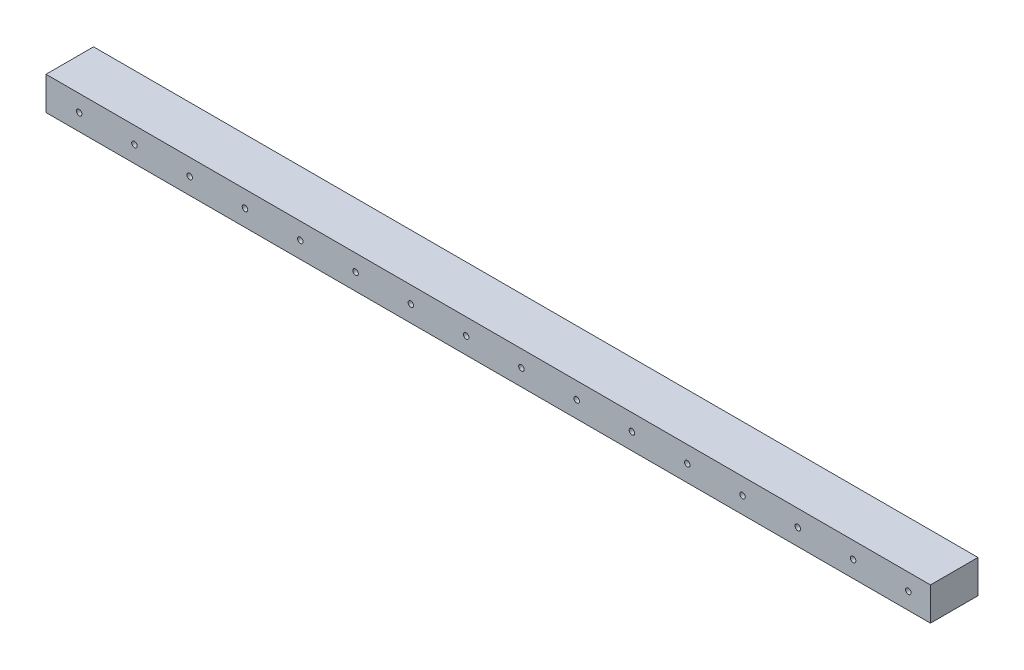
from build123d import *

# Parameters (mm, degrees)
SKETCH_1_W                  = 400
SKETCH_1_H                  = 21.5
EXTRUDE_1_DEPTH             = 15
HOLE_WIZARD_2_5_2_5_1_D     = 2.5
HOLE_WIZARD_2_5_2_5_1_DEPTH = 8.5
HOLE_WIZARD_2_5_2_5_1_TIP   = 0.751075774


with BuildPart() as part:
    # 草图1 → 凸台-拉伸1 (new body)
    with BuildSketch(Plane(origin=(0, 7.5, 0), x_dir=(1, 0, 0), z_dir=(0, 1, 0))):
        with Locations((0, -10.75)):
            Rectangle(SKETCH_1_W, SKETCH_1_H)
    extrude(amount=-EXTRUDE_1_DEPTH)

    # Ø2.5 (2.5) 直径孔1
    with Locations(Plane.XY.offset(21.5)):
        with Locations((-185, 0), (-160, 0), (-135, 0), (-110, 0), (-85, 0), (-60, 0), (-35, 0), (-10, 0), (15, 0), (40, 0), (65, 0), (90, 0), (115, 0), (140, 0), (190, 0), (165, 0)):
            Hole(HOLE_WIZARD_2_5_2_5_1_D / 2, depth=HOLE_WIZARD_2_5_2_5_1_DEPTH)
            with Locations((0, 0, -(HOLE_WIZARD_2_5_2_5_1_DEPTH + HOLE_WIZARD_2_5_2_5_1_TIP / 2))):  # 118° drill point
                Cone(0, HOLE_WIZARD_2_5_2_5_1_D / 2, HOLE_WIZARD_2_5_2_5_1_TIP, mode=Mode.SUBTRACT)


solid = part.part
